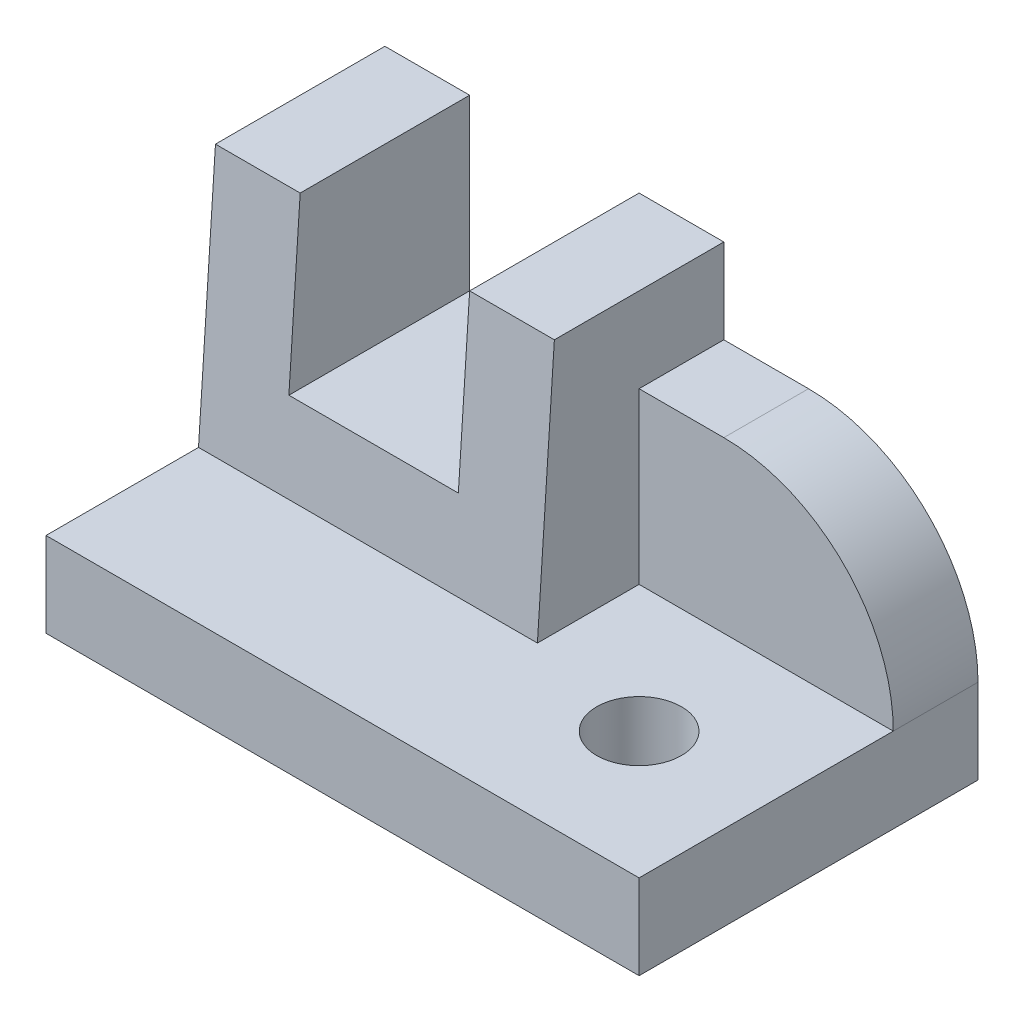
from build123d import *

# Parameters (mm, degrees)
BOSS_EXTRUDE1_DEPTH            = 40
SKETCH2_W                      = 40
SKETCH2_H                      = 30
BOSS_EXTRUDE2_DEPTH            = 20
BOSS_EXTRUDE3_DEPTH            = 30
CUT_EXTRUDE1_DEPTH             = 30
SKETCH5_W                      = 70
SKETCH5_H                      = 40
BOSS_EXTRUDE4_DEPTH            = 10
SKETCH6_W                      = 20
SKETCH6_H                      = 20
CUT_EXTRUDE2_DEPTH             = 91
F_10_0_10_DIAMETER_HOLE1_D     = 10
F_10_0_10_DIAMETER_HOLE1_DEPTH = 40
FILLET1_R                      = 20


with BuildPart() as part:
    # Sketch1 → Boss-Extrude1 (new body)
    with BuildSketch(Plane(origin=(0, 0, 0), x_dir=(0, -1, 0), z_dir=(-1, 0, 0))):
        Polygon((-10, -18), (-40, -20), (-10, -20), align=None)
    extrude(amount=-BOSS_EXTRUDE1_DEPTH)

    # Sketch2 → Boss-Extrude2 (add)
    with BuildSketch(Plane(origin=(0, 0, -20), x_dir=(-1, 0, 0), z_dir=(0, 0, -1))):
        with Locations((-20, 25)):
            Rectangle(SKETCH2_W, SKETCH2_H)
    extrude(amount=BOSS_EXTRUDE2_DEPTH)

    # Sketch3 → Boss-Extrude3 (add)
    with BuildSketch(Plane(origin=(40, 0, 0), x_dir=(0, 0, -1), z_dir=(1, 0, 0))):
        Polygon((40, 10), (0, 10), (20, 40), (40, 40), align=None)
    extrude(amount=BOSS_EXTRUDE3_DEPTH)

    # Sketch4 → Cut-Extrude1 (cut)
    with BuildSketch(Plane(origin=(70, 0, 0), x_dir=(0, 0, -1), z_dir=(1, 0, 0))):
        Polygon((20, 40), (0, 10), (30, 10), (30, 30), (40, 30), (40, 40), align=None)
    extrude(amount=-CUT_EXTRUDE1_DEPTH, mode=Mode.SUBTRACT)

    # Sketch5 → Boss-Extrude4 (add)
    with BuildSketch(Plane.XZ.offset(-10)):
        with Locations((35, -20)):
            Rectangle(SKETCH5_W, SKETCH5_H)
    extrude(amount=BOSS_EXTRUDE4_DEPTH)

    # Sketch6 → Cut-Extrude2 (cut, through all)
    with BuildSketch(Plane(origin=(0, 0, -40), x_dir=(-1, 0, 0), z_dir=(0, 0, -1))):
        with Locations((-20, 30)):
            Rectangle(SKETCH6_W, SKETCH6_H)
    extrude(amount=-CUT_EXTRUDE2_DEPTH, mode=Mode.SUBTRACT)

    # Ø10.0 (10) Diameter Hole1
    with Locations(Plane(origin=(0, 0, 0), x_dir=(-1, 0, 0), z_dir=(0, -1, 0))):
        with Locations((-55, 15)):
            Hole(F_10_0_10_DIAMETER_HOLE1_D / 2, depth=F_10_0_10_DIAMETER_HOLE1_DEPTH)

    # Fillet1
    fillet1_edges = [part.edges().sort_by_distance(p)[0] for p in [
        (70, 30, -35),
    ]]
    fillet(fillet1_edges, radius=FILLET1_R)


solid = part.part
